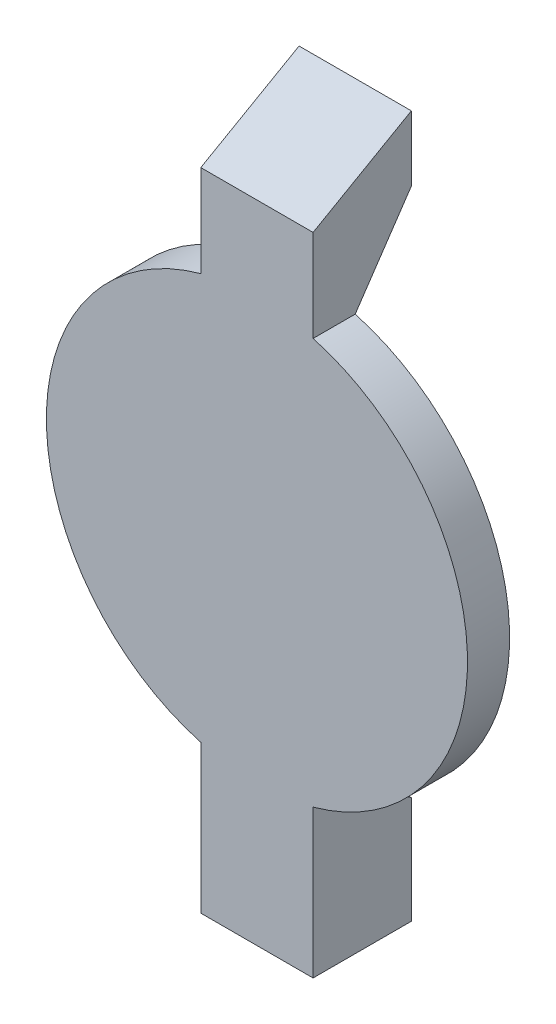
from build123d import *

# Parameters (mm, degrees)
SALIENTE_EXTRUIR1_DEPTH = 7
CROQUIS2_R              = 2.4
CORTAR_EXTRUIR1_DEPTH   = 5
CORTAR_EXTRUIR2_DEPTH   = 8
CROQUIS4_W              = 4
CROQUIS4_H              = 37.728244425
CORTAR_EXTRUIR3_DEPTH   = 40
SALIENTE_EXTRUIR2_DEPTH = 8


with BuildPart() as part:
    # Croquis1 → Saliente-Extruir1 (new body)
    with BuildSketch(Plane.XY):
        with BuildLine():
            Line((-58.064516129, 28.516129032), (-50.064516129, 28.516129032))
            Line((-50.064516129, 28.516129032), (-50.064516129, 17.972961327))
            ThreePointArc((-50.064516129, 17.972961327), (-39.064516129, 3.516129032), (-50.064516129, -10.940703263))
            Line((-50.064516129, -10.940703263), (-50.064516129, -21.483870968))
            Line((-50.064516129, -21.483870968), (-58.064516129, -21.483870968))
            Line((-58.064516129, -21.483870968), (-58.064516129, -10.940703263))
            ThreePointArc((-58.064516129, -10.940703263), (-69.064516129, 3.516129032), (-58.064516129, 17.972961327))
            Line((-58.064516129, 17.972961327), (-58.064516129, 28.516129032))
        make_face()
    extrude(amount=SALIENTE_EXTRUIR1_DEPTH)

    # Croquis2 → Cortar-Extruir1 (cut)
    with BuildSketch(Plane.XZ.offset(21.483870968)):
        with Locations(Location((-54.064516129, 3.5, 0), (0, 0, 270))):
            Circle(CROQUIS2_R)
    extrude(amount=-CORTAR_EXTRUIR1_DEPTH, mode=Mode.SUBTRACT)

    # Croquis3 → Cortar-Extruir2 (cut)
    with BuildSketch(Plane.ZY.offset(58.064516129)):
        Polygon((7, 24.516129032), (0, 28.516129032), (7, 28.516129032), align=None)
    extrude(amount=-CORTAR_EXTRUIR2_DEPTH, mode=Mode.SUBTRACT)

    # Croquis4 → Cortar-Extruir3 (cut)
    with BuildSketch(Plane.ZY.offset(69.064516129)):
        with Locations((2, 5.007952278)):
            Rectangle(CROQUIS4_W, CROQUIS4_H)
    extrude(amount=-CORTAR_EXTRUIR3_DEPTH, mode=Mode.SUBTRACT)

    # Croquis5 → Saliente-Extruir2 (add)
    with BuildSketch(Plane.ZY.offset(58.064516129)):
        Polygon((0, 23.87207449), (4, 17.972961327), (4, 23.87207449), align=None)
        Polygon((0, -13.856169935), (4, -10.940703263), (4, -13.856169935), align=None)
    extrude(amount=-SALIENTE_EXTRUIR2_DEPTH)


solid = part.part
